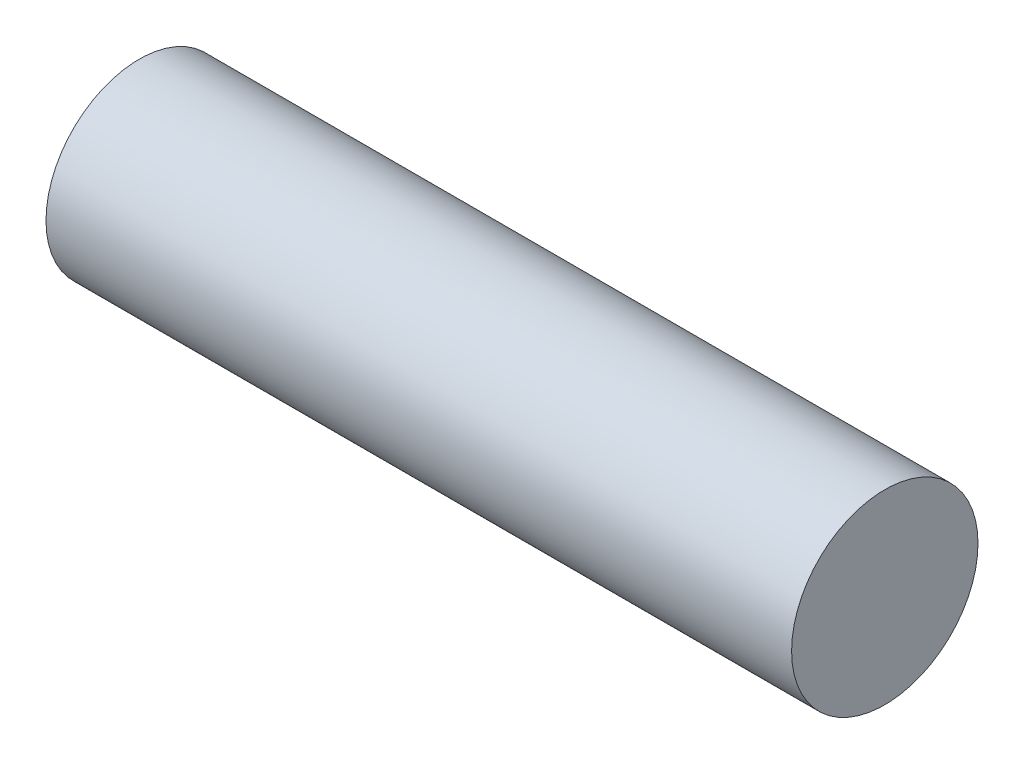
from build123d import *

# Parameters (mm, degrees)
SKETCH2_R           = 10
BOSS_EXTRUDE1_DEPTH = 80


with BuildPart() as part:
    # Sketch2 → Boss-Extrude1 (new body)
    with BuildSketch(Plane(origin=(0, 0, 0), x_dir=(0, 0, -1), z_dir=(1, 0, 0))):
        Circle(SKETCH2_R)
    extrude(amount=-BOSS_EXTRUDE1_DEPTH)


solid = part.part
